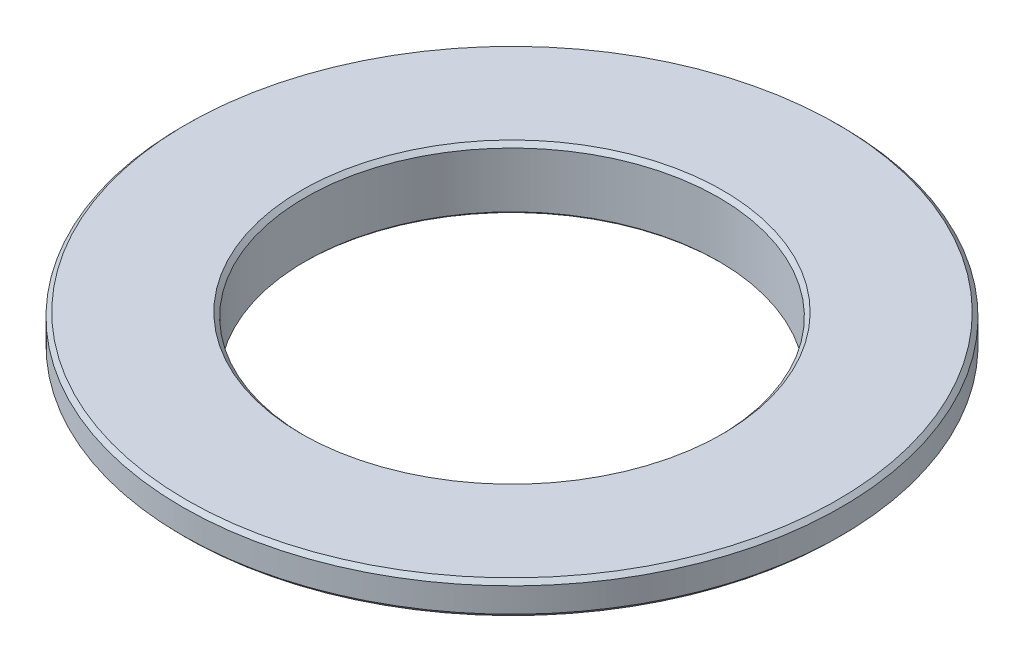
from build123d import *

# Parameters (mm, degrees)
SKETCH_1_W      = 80.5
SKETCH_1_H      = 8
SKETCH_2_R      = 65.25
EXTRUDE_1_DEPTH = 7
HOLE_WIZARD_3_D = 101
CHAMFER_1_SIZE  = 0.5
CHAMFER_2_SIZE2 = 1.000000001
CHAMFER_2_SIZE  = 0.999999999


with BuildPart() as part:
    # 草圖1 → 旋轉1 (revolve)
    with BuildSketch(Plane.XY, mode=Mode.PRIVATE) as revolve_1_sk:
        with Locations((40.25, 15)):
            Rectangle(SKETCH_1_W, SKETCH_1_H)
    revolve(revolve_1_sk.sketch.rotate(Axis((0, 19, 0), (0, -1, 0)), 270), axis=Axis((0, 19, 0), (0, -1, 0)))

    # 草圖2 → 填料-伸長1 (add)
    with BuildSketch(Plane.XZ.offset(-11)):
        with Locations(Location((0, 0, 0), (0, 0, 90))):
            Circle(SKETCH_2_R)
    extrude(amount=EXTRUDE_1_DEPTH)

    # 鑽孔3 (through all)
    with Locations(Plane(origin=(0, 4, 0), x_dir=(-1, 0, 0), z_dir=(0, -1, 0))):
        with Locations((0, 0)):
            Hole(HOLE_WIZARD_3_D / 2)

    # 導角1
    chamfer_1_edges = [part.edges().sort_by_distance(p)[0] for p in [
        (0, 4, -65.25),
        (-50.5, 4, 0),
    ]]
    chamfer(chamfer_1_edges, length=CHAMFER_1_SIZE)

    # 導角2
    chamfer_2_edges = [part.edges().sort_by_distance(p)[0] for p in [
        (-50.5, 19, 0),
        (0, 11, 80.5),
        (0, 19, 80.5),
    ]]
    chamfer(chamfer_2_edges, length=CHAMFER_2_SIZE, length2=CHAMFER_2_SIZE2)


solid = part.part
